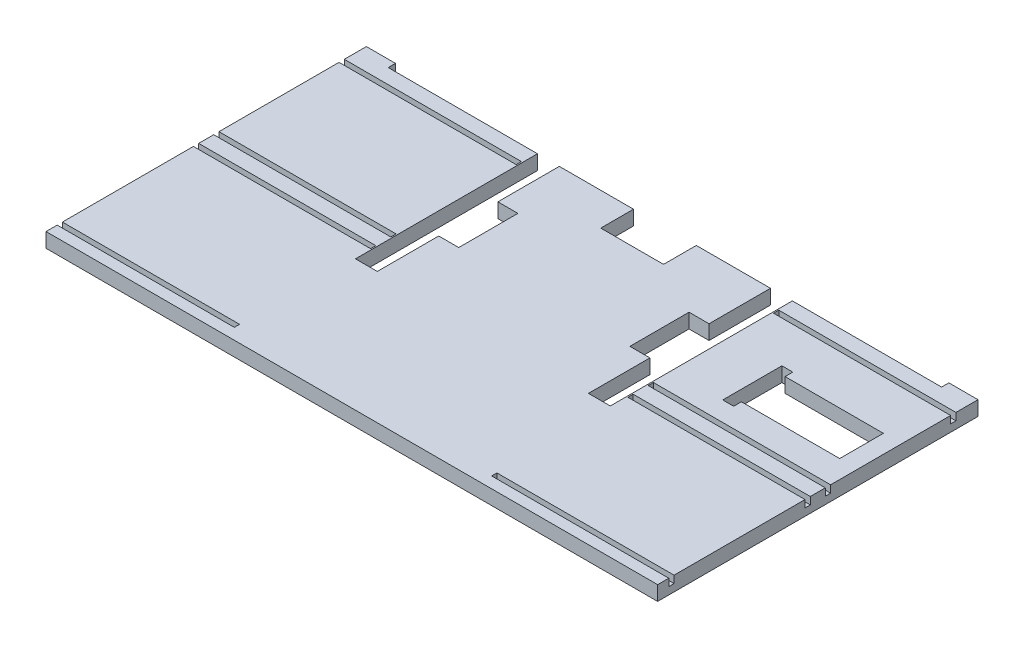
from build123d import *

# Parameters (mm, degrees)
SKETCH1_W           = 533.4
SKETCH1_H           = 279.4
BOSS_EXTRUDE1_DEPTH = 6.35
SKETCH2_W           = 482.6
SKETCH2_H           = 6.35
CUT_EXTRUDE1_DEPTH  = 302.34078715
SKETCH3_W           = 19.05
SKETCH3_H           = 158.75
CUT_EXTRUDE2_DEPTH  = 302.34078715
SKETCH4_W           = 17.4498
SKETCH4_H           = 51.59375
CUT_EXTRUDE3_DEPTH  = 302.34078715
SKETCH5_W           = 54.76875
SKETCH5_H           = 28.575
CUT_EXTRUDE4_DEPTH  = 302.34078715
SKETCH6_W           = 154.4828
SKETCH6_H           = 4.6
CUT_EXTRUDE5_DEPTH  = 6.35


with BuildPart() as part:
    # Sketch1 → Boss-Extrude1 (new, symmetric)
    with BuildSketch(Plane(origin=(0, 0, 0), x_dir=(1, 0, 0), z_dir=(0, 1, 0))):
        Rectangle(SKETCH1_W, SKETCH1_H)
    extrude(amount=BOSS_EXTRUDE1_DEPTH, both=True)

    # Sketch2 → Cut-Extrude1 (cut, through all)
    with BuildSketch(Plane(origin=(0, 6.35, 0), x_dir=(1, 0, 0), z_dir=(0, 1, 0))):
        with Locations((0, 136.525)):
            Rectangle(SKETCH2_W, SKETCH2_H)
    extrude(amount=-CUT_EXTRUDE1_DEPTH, mode=Mode.SUBTRACT)

    # Sketch3 → Cut-Extrude2 (cut, through all)
    with BuildSketch(Plane(origin=(0, 6.35, 0), x_dir=(1, 0, 0), z_dir=(0, 1, 0))):
        with Locations((-101.6, 53.975)):
            Rectangle(SKETCH3_W, SKETCH3_H)
        with Locations((101.6, 53.975)):
            Rectangle(SKETCH3_W, SKETCH3_H)
    extrude(amount=-CUT_EXTRUDE2_DEPTH, mode=Mode.SUBTRACT)

    # Sketch4 → Cut-Extrude3 (cut, through all)
    with BuildSketch(Plane(origin=(0, 6.35, 0), x_dir=(1, 0, 0), z_dir=(0, 1, 0))):
        Polygon((165.1254, 73.025), (250.8504, 73.025), (250.8504, 34.925), (165.1254, 34.925), (165.1254, 28.178125), (155.6004, 28.178125), (155.6004, 79.771875), (165.1254, 79.771875), align=None)
        with Locations((-83.3501, 53.975)):
            Rectangle(SKETCH4_W, SKETCH4_H)
        with Locations((83.3501, 53.975)):
            Rectangle(SKETCH4_W, SKETCH4_H)
    extrude(amount=-CUT_EXTRUDE3_DEPTH, mode=Mode.SUBTRACT)

    # Sketch5 → Cut-Extrude4 (cut, through all)
    with BuildSketch(Plane(origin=(0, 6.35, 0), x_dir=(1, 0, 0), z_dir=(0, 1, 0))):
        with Locations((0, 119.0625)):
            Rectangle(SKETCH5_W, SKETCH5_H)
    extrude(amount=-CUT_EXTRUDE4_DEPTH, mode=Mode.SUBTRACT)

    # Sketch6 → Cut-Extrude5 (cut)
    with BuildSketch(Plane(origin=(0, 6.35, 0), x_dir=(1, 0, 0), z_dir=(0, 1, 0))):
        with Locations((-189.4586, -127.675)):
            Rectangle(SKETCH6_W, SKETCH6_H)
        with Locations((-189.4586, 8.85)):
            Rectangle(SKETCH6_W, SKETCH6_H)
        with Locations((-189.4586, 118.15)):
            Rectangle(SKETCH6_W, SKETCH6_H)
        with Locations((-189.4586, -8.85)):
            Rectangle(SKETCH6_W, SKETCH6_H)
    cut_extrude5 = extrude(amount=-CUT_EXTRUDE5_DEPTH, mode=Mode.SUBTRACT)

    # Mirror1: Cut-Extrude5 across plane
    add(cut_extrude5.mirror(Plane(origin=(0, 0, 0), x_dir=(0, 0, 1), z_dir=(1, 0, 0))), mode=Mode.SUBTRACT)


solid = part.part
